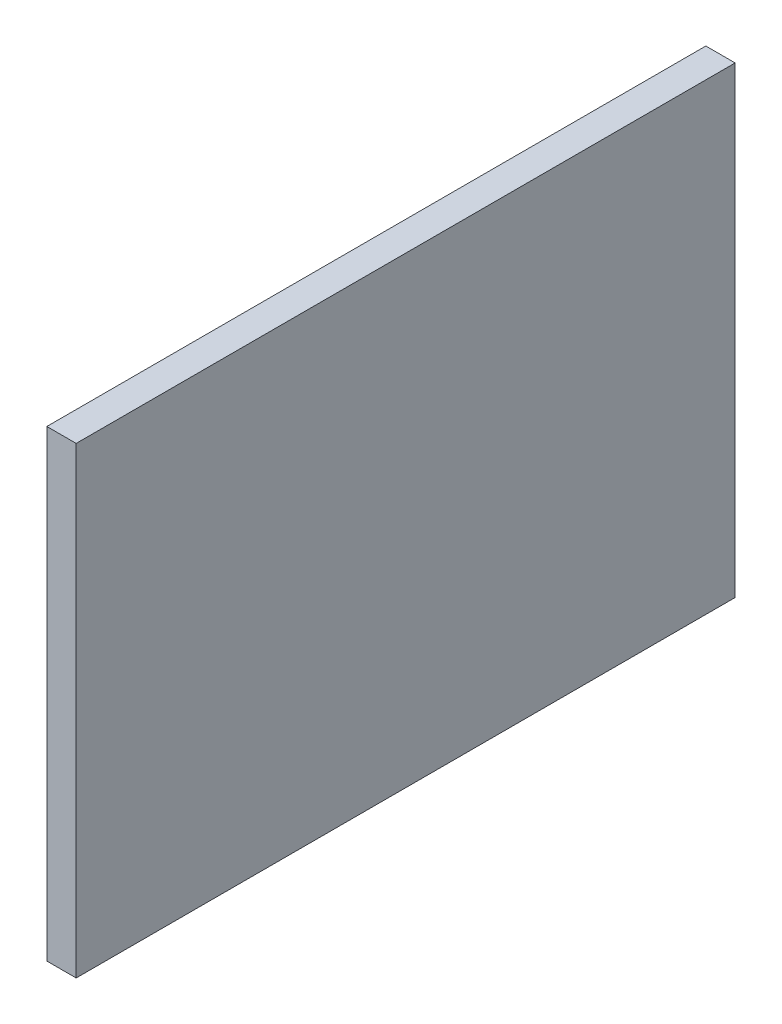
from build123d import *

# Parameters (mm, degrees)
SKETCH1_W           = 427
SKETCH1_H           = 300
BOSS_EXTRUDE1_DEPTH = 19


with BuildPart() as part:
    # Sketch1 → Boss-Extrude1 (new body)
    with BuildSketch(Plane(origin=(0, 0, 0), x_dir=(0, 0, -1), z_dir=(1, 0, 0))):
        with Locations((213.5, 150)):
            Rectangle(SKETCH1_W, SKETCH1_H)
    extrude(amount=BOSS_EXTRUDE1_DEPTH)


solid = part.part
